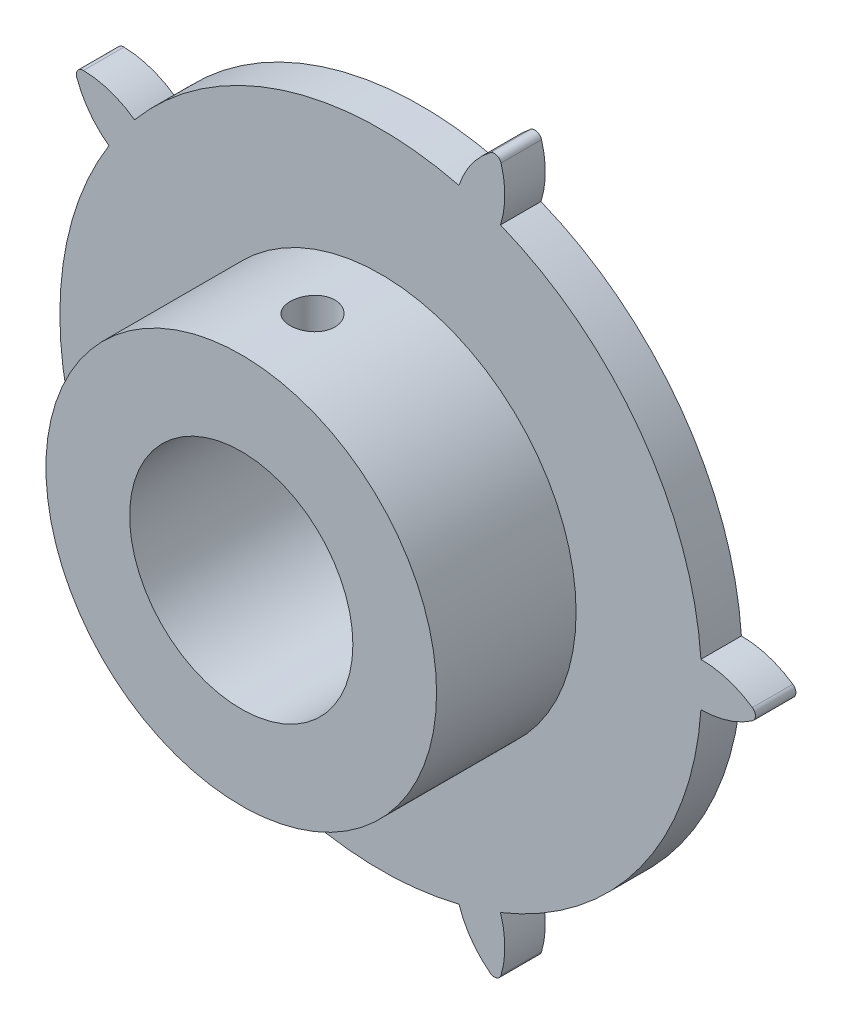
from build123d import *

# Parameters (mm, degrees)
SKETCH1_R                 = 11.5
BOSS_EXTRUDE1_DEPTH       = 1.45
BOSS_EXTRUDE2_DEPTH       = 1.45
CIRPATTERN2_COUNT         = 5
SKETCH4_R                 = 4
CUT_EXTRUDE1_DEPTH        = 1.45
BOSS_EXTRUDE3_START       = 5
SKETCH5_R                 = 7
SKETCH5_R_2               = 4
BOSS_EXTRUDE3_DEPTH       = 5
M2X0_4_TAPPED_HOLE3_D     = 1.6
M2X0_4_TAPPED_HOLE3_DEPTH = 5.2
M2X0_4_TAPPED_HOLE3_TIP   = 0.480688495


with BuildPart() as part:
    # Sketch1 → Boss-Extrude1 (new body)
    with BuildSketch(Plane.XY):
        Circle(SKETCH1_R)
    extrude(amount=BOSS_EXTRUDE1_DEPTH)

    # Sketch2 → Boss-Extrude2 (add)
    with BuildSketch(Plane.XY.offset(1.45)):
        with BuildLine():
            Line((11.466388324, -0.781762992), (11.466388324, 0.781762992))
            ThreePointArc((11.466388324, 0.781762992), (12.435767446, 0.634469665), (13.317644229, 0.205885315))
            ThreePointArc((13.317644229, 0.205885315), (13.425830137, 0), (13.317644229, -0.205885315))
            ThreePointArc((13.317644229, -0.205885315), (12.435767446, -0.634469665), (11.466388324, -0.781762992))
        make_face()
    boss_extrude2 = extrude(amount=-BOSS_EXTRUDE2_DEPTH)

    # CirPattern2: Boss-Extrude2 ×5 about axis
    cirpattern2_axis = Axis((0, 0, 0), (0, 0, 1))
    for i in range(1, CIRPATTERN2_COUNT):
        add(boss_extrude2.rotate(cirpattern2_axis, i * 360 / CIRPATTERN2_COUNT))

    # Sketch4 → Cut-Extrude1 (cut)
    with BuildSketch(Plane.XY.offset(1.45)):
        Circle(SKETCH4_R)
    extrude(amount=-CUT_EXTRUDE1_DEPTH, mode=Mode.SUBTRACT)

    # Sketch5 → Boss-Extrude3 (add)
    with BuildSketch(Plane.XY.offset(1.45).offset(BOSS_EXTRUDE3_START)):
        Circle(SKETCH5_R)
        Circle(SKETCH5_R_2, mode=Mode.SUBTRACT)
    extrude(amount=-BOSS_EXTRUDE3_DEPTH)

    # M2x0.4 Tapped Hole3
    with Locations(Plane(origin=(-0.021974878, 6.999965507, 3.87491846), x_dir=(0.999995072485, 0.003139268242, 0), z_dir=(-0.003139268242, 0.999995072485, 0))):
        with Locations((0, 0)):
            Hole(M2X0_4_TAPPED_HOLE3_D / 2, depth=M2X0_4_TAPPED_HOLE3_DEPTH)
            with Locations((0, 0, -(M2X0_4_TAPPED_HOLE3_DEPTH + M2X0_4_TAPPED_HOLE3_TIP / 2))):  # 118° drill point
                Cone(0, M2X0_4_TAPPED_HOLE3_D / 2, M2X0_4_TAPPED_HOLE3_TIP, mode=Mode.SUBTRACT)


solid = part.part
